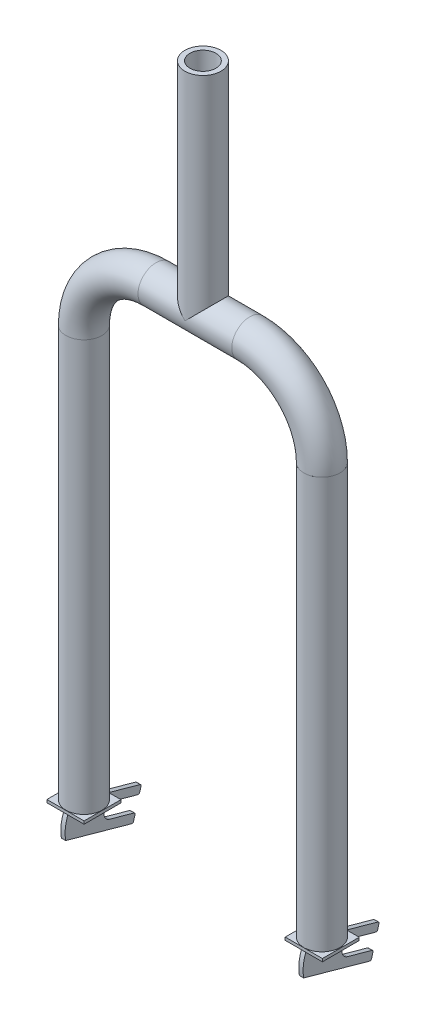
from build123d import *

# Parameters (mm, degrees)
SKETCH11_ON_SEGMENT_1_R       = 12.52
SKETCH11_ON_SEGMENT_1_R_2     = 9.02
NEW_FOLDER_FORK_ROD_1_DEPTH   = 285
SKETCH11_ON_SEGMENT_2_R       = 12.52
SKETCH11_ON_SEGMENT_2_R_2     = 9.02
NEW_FOLDER_FORK_ROD_1_2_ANGLE = 90
SKETCH11_ON_SEGMENT_3_R       = 12.52
SKETCH11_ON_SEGMENT_3_R_2     = 9.02
NEW_FOLDER_FORK_ROD_1_3_DEPTH = 65
SKETCH11_ON_SEGMENT_4_R       = 12.52
SKETCH11_ON_SEGMENT_4_R_2     = 9.02
NEW_FOLDER_FORK_ROD_1_4_ANGLE = 90
SKETCH11_R                    = 12.52
SKETCH11_R_2                  = 9.02
NEW_FOLDER_FORK_ROD_1_5_DEPTH = 285
SKETCH12_R                    = 12.52
SKETCH12_R_2                  = 9.02
NEW_FOLDER_FORK_ROD_2_DEPTH   = 150
SKETCH13_W                    = 25.760248547
SKETCH13_H                    = 25.550815633
BOSS_EXTRUDE1_DEPTH           = 2
BOSS_EXTRUDE2_DEPTH           = 1.5


with BuildPart() as part:
    # Sketch11 on segment 1 (carried to segment 1) → New folder FORK ROD(1) (new body)
    with BuildSketch(Plane(origin=(82.5, -50, 0), x_dir=(1, 0, 0), z_dir=(0, -1, 0))):
        Circle(SKETCH11_ON_SEGMENT_1_R)
        Circle(SKETCH11_ON_SEGMENT_1_R_2, mode=Mode.SUBTRACT)
    extrude(amount=NEW_FOLDER_FORK_ROD_1_DEPTH)


with BuildPart() as body_2:
    # Sketch11 on segment 2 (carried to the start of arc 2) → New folder FORK ROD_1 2 (revolve)
    with BuildSketch(Plane(origin=(82.5, -50, 0), x_dir=(-1, 0, 0), z_dir=(0, 1, 0))):
        Circle(SKETCH11_ON_SEGMENT_2_R)
        Circle(SKETCH11_ON_SEGMENT_2_R_2, mode=Mode.SUBTRACT)
    revolve(axis=Axis((32.5, -50, 0), (0, 0, 1)), revolution_arc=NEW_FOLDER_FORK_ROD_1_2_ANGLE)


with BuildPart() as body_3:
    # Sketch11 on segment 3 (carried to segment 3) → New folder FORK ROD_1 3 (new body)
    with BuildSketch(Plane(origin=(32.5, 0, 0), x_dir=(0, -1, 0), z_dir=(-1, 0, 0))):
        Circle(SKETCH11_ON_SEGMENT_3_R)
        Circle(SKETCH11_ON_SEGMENT_3_R_2, mode=Mode.SUBTRACT)
    extrude(amount=NEW_FOLDER_FORK_ROD_1_3_DEPTH)


with BuildPart() as body_4:
    # Sketch11 on segment 4 (carried to the start of arc 4) → New folder FORK ROD_1 4 (revolve)
    with BuildSketch(Plane(origin=(-82.5, -50, 0), x_dir=(-1, 0, 0), z_dir=(0, 1, 0))):
        Circle(SKETCH11_ON_SEGMENT_4_R)
        Circle(SKETCH11_ON_SEGMENT_4_R_2, mode=Mode.SUBTRACT)
    revolve(axis=Axis((-32.5, -50, 0), (0, 0, -1)), revolution_arc=NEW_FOLDER_FORK_ROD_1_4_ANGLE)


with BuildPart() as body_5:
    # Sketch11 → New folder FORK ROD_1 5 (new body)
    with BuildSketch(Plane(origin=(-82.5, -50, 0), x_dir=(1, 0, 0), z_dir=(0, -1, 0))):
        Circle(SKETCH11_R)
        Circle(SKETCH11_R_2, mode=Mode.SUBTRACT)
    extrude(amount=NEW_FOLDER_FORK_ROD_1_5_DEPTH)


with BuildPart() as body_6:
    # Sketch12 → New folder FORK ROD(2) (new body)
    with BuildSketch(Plane(origin=(0, 0, 0), x_dir=(-1, 0, 0), z_dir=(0, 1, 0))):
        Circle(SKETCH12_R)
        Circle(SKETCH12_R_2, mode=Mode.SUBTRACT)
    extrude(amount=NEW_FOLDER_FORK_ROD_2_DEPTH)

    # Trim/Extend1: cut back where it meets the other member's skin (coped)
    split(bisect_by=body_3.part.faces().sort_by_distance((0, 12.52, 0))[0], keep=Keep.TOP)


with BuildPart() as body_7:
    # Sketch13 → Boss-Extrude1 (new body)
    with BuildSketch(Plane(origin=(0, -335, 0), x_dir=(-1, 0, 0), z_dir=(0, -1, 0))):
        with Locations((82.621284974, 0.104716457)):
            Rectangle(SKETCH13_W, SKETCH13_H)
    extrude(amount=BOSS_EXTRUDE1_DEPTH)


with BuildPart() as body_8:
    # Mirror1: mirrored copy
    add(body_7.part.mirror(Plane(origin=(0, 0, 0), x_dir=(0, 0, 1), z_dir=(1, 0, 0))))


with BuildPart() as body_9:
    # Sketch14 → Boss-Extrude2 (new, symmetric)
    with BuildSketch(Plane(origin=(82.5, 0, 0), x_dir=(0, 0, -1), z_dir=(1, 0, 0))):
        with BuildLine():
            Line((38.10548457, -345.070087153), (37.153732285, -348.484255875))
            ThreePointArc((37.153732285, -348.484255875), (36.681719141, -349.086742414), (35.921933129, -349.179001036))
            Line((35.921933129, -349.179001036), (18.815979596, -344.410452181))
            ThreePointArc((18.815979596, -344.410452181), (12.656983814, -347.884177984), (16.130709617, -354.043173767))
            Line((16.130709617, -354.043173767), (33.23666315, -358.811722621))
            ThreePointArc((33.23666315, -358.811722621), (33.839149688, -359.283735765), (33.93140831, -360.043521778))
            Line((33.93140831, -360.043521778), (32.886950587, -363.790247633))
            ThreePointArc((32.886950587, -363.790247633), (32.414937442, -364.392734172), (31.65515143, -364.484992794))
            Line((31.65515143, -364.484992794), (-14.154820916, -351.714755184))
            ThreePointArc((-14.154820916, -351.714755184), (-14.422743073, -344.255510354), (-12.670691359, -337))
            Line((-12.670691359, -337), (12.880124274, -337))
            Line((12.880124274, -337), (37.410739409, -343.838287996))
            ThreePointArc((37.410739409, -343.838287996), (38.013225948, -344.310301141), (38.10548457, -345.070087153))
        make_face()
    extrude(amount=BOSS_EXTRUDE2_DEPTH, both=True)


with BuildPart() as body_10:
    # Mirror2: mirrored copy
    add(body_9.part.mirror(Plane(origin=(0, 0, 0), x_dir=(0, 0, 1), z_dir=(1, 0, 0))))


solid = Compound([part.part, body_2.part, body_3.part, body_4.part, body_5.part, body_6.part, body_7.part, body_8.part, body_9.part, body_10.part])
